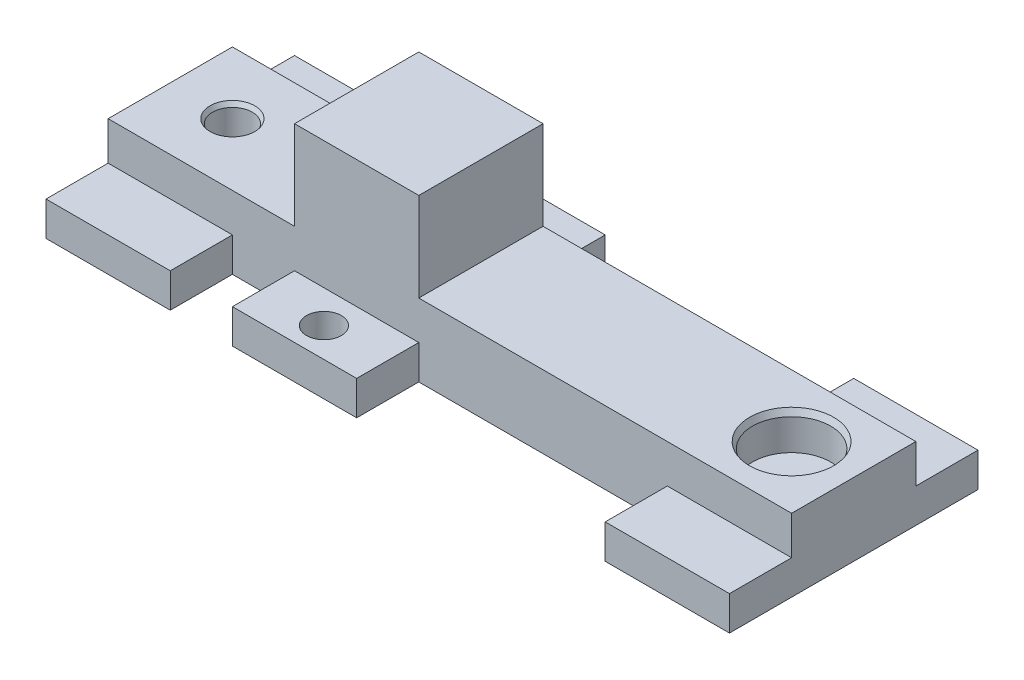
from build123d import *
from OCP.BRepFilletAPI import BRepFilletAPI_MakeChamfer

# Parameters (mm, degrees)
SKETCH1_W           = 55
SKETCH1_H           = 20
BOSS_EXTRUDE1_DEPTH = 6.5
SKETCH2_W           = 10
SKETCH2_H           = 10
CUT_EXTRUDE3_DEPTH  = 7.15
SKETCH6_W           = 55
SKETCH6_H           = 5
CUT_EXTRUDE4_DEPTH  = 3.1
SKETCH7_R           = 1.6
CUT_EXTRUDE5_DEPTH  = 10
SKETCH9_W           = 5
SKETCH9_H           = 5
SKETCH9_W_2         = 20
CUT_EXTRUDE6_DEPTH  = 3
SKETCH10_R          = 1.4
CUT_EXTRUDE7_DEPTH  = 3
CHAMFER1_SIZE       = 0.2
CHAMFER1_SIZE2      = 0.346410162
SKETCH12_R          = 3.15
CUT_EXTRUDE8_DEPTH  = 3
CHAMFER2_SIZE       = 0.5
CHAMFER2_SIZE2      = 0.233153829


with BuildPart() as part:
    # Sketch1 → Boss-Extrude1 (new, symmetric)
    with BuildSketch(Plane(origin=(0, 0, 0), x_dir=(1, 0, 0), z_dir=(0, 1, 0))):
        with Locations((7.5, 0)):
            Rectangle(SKETCH1_W, SKETCH1_H)
    extrude(amount=BOSS_EXTRUDE1_DEPTH, both=True)

    # Sketch2 → Cut-Extrude3 (cut)
    with BuildSketch(Plane(origin=(0, 6.5, 0), x_dir=(1, 0, 0), z_dir=(0, 1, 0))):
        Polygon((-5, -10), (-20, -10), (-20, 10), (-5, 10), (5, 10), (35, 10), (35, -10), (5, -10), align=None)
        Rectangle(SKETCH2_W, SKETCH2_H, mode=Mode.SUBTRACT)
    extrude(amount=-CUT_EXTRUDE3_DEPTH, mode=Mode.SUBTRACT)

    # Sketch6 → Cut-Extrude4 (cut)
    with BuildSketch(Plane(origin=(0, -0.65, 0), x_dir=(1, 0, 0), z_dir=(0, 1, 0))):
        with Locations((7.5, -7.5)):
            Rectangle(SKETCH6_W, SKETCH6_H)
        Polygon((-5, 5), (-20, 5), (-20, 10), (35, 10), (35, 5), align=None)
    extrude(amount=-CUT_EXTRUDE4_DEPTH, mode=Mode.SUBTRACT)

    # Sketch7 → Cut-Extrude5 (cut)
    with BuildSketch(Plane.XZ.offset(6.5)):
        with Locations(Location((-15, 0, 0), (0, 0, 270))):
            Circle(SKETCH7_R)
    extrude(amount=-CUT_EXTRUDE5_DEPTH, mode=Mode.SUBTRACT)

    # Sketch9 → Cut-Extrude6 (cut)
    with BuildSketch(Plane(origin=(0, -3.75, 0), x_dir=(1, 0, 0), z_dir=(0, 1, 0))):
        with Locations((-7.5, 7.5)):
            Rectangle(SKETCH9_W, SKETCH9_H)
        with Locations((-7.5, -7.5)):
            Rectangle(SKETCH9_W, SKETCH9_H)
        with Locations((15, 7.5)):
            Rectangle(SKETCH9_W_2, SKETCH9_H)
        with Locations((15, -7.5)):
            Rectangle(SKETCH9_W_2, SKETCH9_H)
    extrude(amount=-CUT_EXTRUDE6_DEPTH, mode=Mode.SUBTRACT)

    # Sketch10 → Cut-Extrude7 (cut)
    with BuildSketch(Plane(origin=(0, -3.75, 0), x_dir=(1, 0, 0), z_dir=(0, 1, 0))):
        with Locations(Location((0, 7.636752006, 0), (0, 0, 270))):
            Circle(SKETCH10_R)
        with Locations(Location((0, -7.636752006, 0), (0, 0, 270))):
            Circle(SKETCH10_R)
    extrude(amount=-CUT_EXTRUDE7_DEPTH, mode=Mode.SUBTRACT)

    # Chamfer1: one chamfer whose edges measure the first distance from different faces: ONE call of the kernel's chamfer builder (chamfer() names one face for all edges)
    chamfer1_edges_1 = [part.edges().sort_by_distance(p)[0] for p in [
        (0, -6.5, 6.236752006),
        (-15, -6.5, 1.6),
    ]]
    chamfer1_side_1 = [part.faces().sort_by_distance(p)[0] for p in [
        (6.925437522, -6.5, 0),
    ]]
    chamfer1_edges_2 = [part.edges().sort_by_distance(p)[0] for p in [
        (0, -6.5, -9.036752006),
    ]]
    chamfer1_side_2 = [part.faces().sort_by_distance(p)[0] for p in [
        (0, -5.125, -9.036752006),
    ]]
    chamfer1_edges_3 = [part.edges().sort_by_distance(p)[0] for p in [
        (-15, -0.65, 1.6),
    ]]
    chamfer1_side_3 = [part.faces().sort_by_distance(p)[0] for p in [
        (-12.358364724, -0.65, 0),
    ]]
    chamfer1 = BRepFilletAPI_MakeChamfer(part.part.solid().wrapped)
    for e in chamfer1_edges_1:
        chamfer1.Add(CHAMFER1_SIZE, CHAMFER1_SIZE2, e.wrapped, chamfer1_side_1[0].wrapped)  # the first distance lies on this face
    for e in chamfer1_edges_2:
        chamfer1.Add(CHAMFER1_SIZE, CHAMFER1_SIZE2, e.wrapped, chamfer1_side_2[0].wrapped)  # the first distance lies on this face
    for e in chamfer1_edges_3:
        chamfer1.Add(CHAMFER1_SIZE, CHAMFER1_SIZE2, e.wrapped, chamfer1_side_3[0].wrapped)  # the first distance lies on this face
    add(Compound.cast(chamfer1.Shape()), mode=Mode.REPLACE)

    # Sketch12 → Cut-Extrude8 (cut)
    with BuildSketch(Plane(origin=(0, -0.65, 0), x_dir=(1, 0, 0), z_dir=(0, 1, 0))):
        with Locations(Location((30, 0, 0), (0, 0, 270))):
            Circle(SKETCH12_R)
    extrude(amount=-CUT_EXTRUDE8_DEPTH, mode=Mode.SUBTRACT)

    # Chamfer2
    chamfer2_edges = [part.edges().sort_by_distance(p)[0] for p in [
        (30, -0.65, -3.15),
    ]]
    chamfer2_side = [part.faces().sort_by_distance(p)[0] for p in [
        (30, -2.15, -3.15),
    ]]
    chamfer(chamfer2_edges, length=CHAMFER2_SIZE, length2=CHAMFER2_SIZE2, reference=chamfer2_side[0])


solid = part.part
